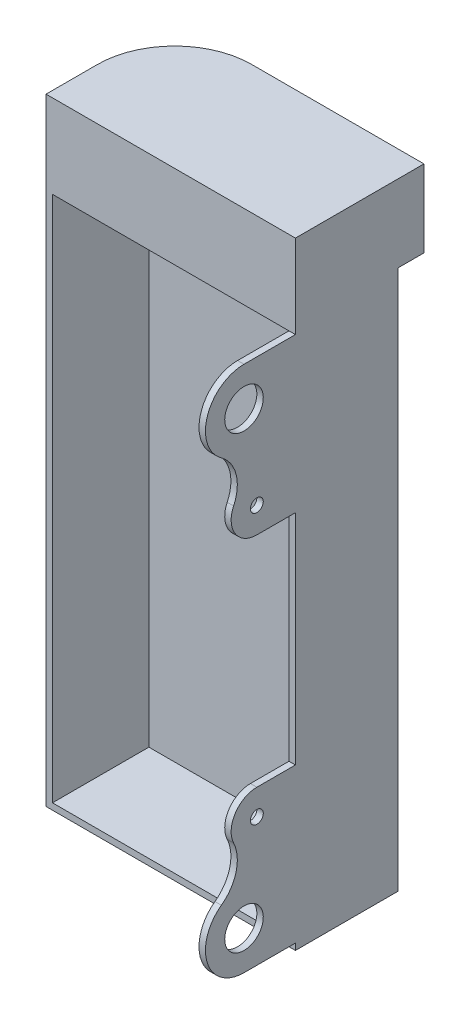
from build123d import *

# Parameters (mm, degrees)
SKETCH1_W           = 123.19
SKETCH1_H           = 266.7
BOSS_EXTRUDE1_DEPTH = 25.4
SHELL1_T            = -3.175
SKETCH2_R           = 9.525
SKETCH2_R_2         = 3.175
BOSS_EXTRUDE2_DEPTH = 3.175
BOSS_EXTRUDE3_DEPTH = 38.1


with BuildPart() as part:
    # Sketch1 → Boss-Extrude1 (new, symmetric)
    with BuildSketch(Plane.XY):
        Rectangle(SKETCH1_W, SKETCH1_H)
    extrude(amount=BOSS_EXTRUDE1_DEPTH, both=True)

    # Shell1
    shell1_openings = [part.faces().sort_by_distance(p)[0] for p in [
        (0, 0, 25.4),
    ]]
    offset(amount=SHELL1_T, openings=shell1_openings, kind=Kind.INTERSECTION)

    # Sketch2 → Boss-Extrude2 (add)
    with BuildSketch(Plane.ZY.offset(-58.42)):
        with BuildLine():
            Line((50.8, 130.175), (25.4, 130.175))
            Line((25.4, 130.175), (25.4, 53.975))
            Line((25.4, 53.975), (44.45, 53.975))
            ThreePointArc((44.45, 53.975), (55.181439518, 59.883372369), (55.927786008, 72.11103057))
            ThreePointArc((55.927786008, 72.11103057), (54.690903616, 84.99461885), (61.97223251, 95.695038213))
            ThreePointArc((61.97223251, 95.695038213), (68.922407015, 116.99704087), (50.8, 130.175))
        make_face()
        with Locations(Location((50.8, 111.125, 0), (0, 0, 270))):
            Circle(SKETCH2_R, mode=Mode.SUBTRACT)
        with Locations(Location((44.45, 66.675, 0), (0, 0, 270))):
            Circle(SKETCH2_R_2, mode=Mode.SUBTRACT)
    boss_extrude2 = extrude(amount=-BOSS_EXTRUDE2_DEPTH)

    # Sketch3 → Boss-Extrude3 (add)
    with BuildSketch(Plane(origin=(0, 133.35, 0), x_dir=(1, 0, 0), z_dir=(0, 1, 0))):
        with BuildLine():
            Line((-61.595, -25.4), (61.595, -25.4))
            Line((61.595, -25.4), (61.595, 38.1))
            Line((61.595, 38.1), (-23.495, 38.1))
            ThreePointArc((-23.495, 38.1), (-50.435768363, 26.940768363), (-61.595, 0))
            Line((-61.595, 0), (-61.595, -25.4))
        make_face()
    extrude(amount=BOSS_EXTRUDE3_DEPTH)

    # Mirror1: Boss-Extrude2 across plane
    add(boss_extrude2.mirror(Plane.ZX))


solid = part.part
